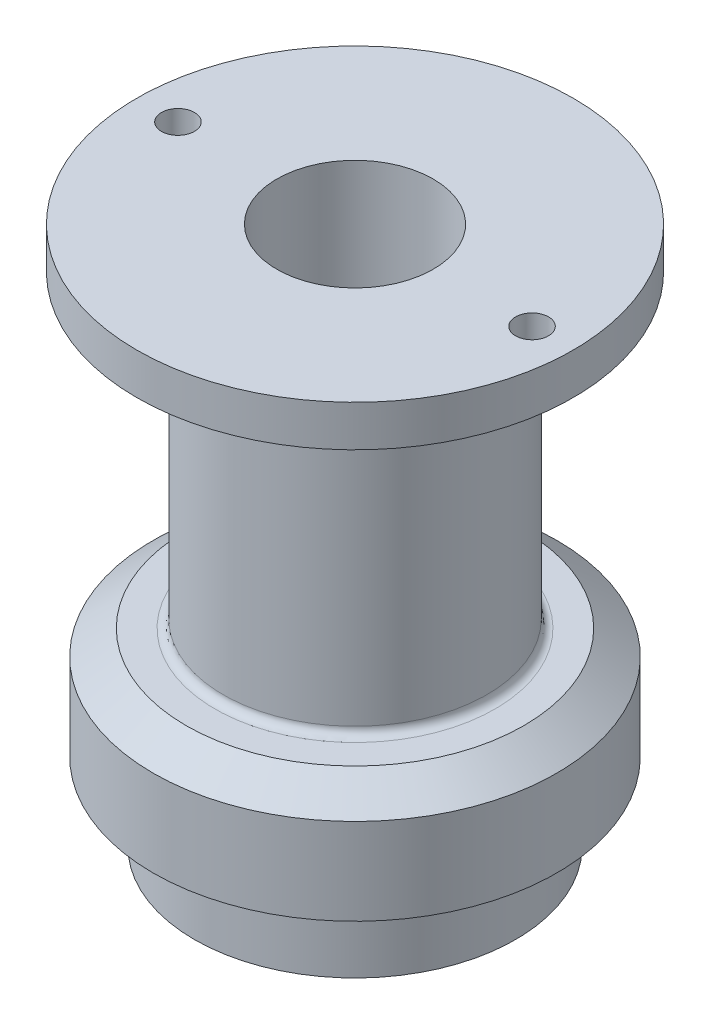
from build123d import *

# Parameters (mm, degrees)
SKETCH2_R          = 2
CUT_EXTRUDE1_DEPTH = 10


with BuildPart() as part:
    # Sketch1 → Revolve1 (revolve)
    with BuildSketch(Plane.XY, mode=Mode.PRIVATE) as revolve1_sk:
        with BuildLine():
            Line((13.5, 0), (19.5, 0))
            Line((19.5, 0), (19.5, 8))
            Line((19.5, 8), (18, 8))
            Line((18, 8), (18, 9.5))
            Line((18, 9.5), (24.5, 9.5))
            Line((24.5, 9.5), (24.5, 20))
            Line((24.5, 20), (20.5, 23))
            Line((20.5, 23), (17, 23))
            ThreePointArc((17, 23), (16.292893219, 23.292893219), (16, 24))
            Line((16, 24), (16, 59.5))
            ThreePointArc((16, 59.5), (16.292893219, 60.207106781), (17, 60.5))
            Line((17, 60.5), (26.5, 60.5))
            Line((26.5, 60.5), (26.5, 65.5))
            Line((26.5, 65.5), (9.5, 65.5))
            Line((9.5, 65.5), (9.5, 48))
            Line((9.5, 48), (6.5, 44.5))
            Line((6.5, 44.5), (6.5, 37.5))
            Line((6.5, 37.5), (7, 37))
            Line((7, 37), (7, 17))
            Line((7, 17), (6.5, 16.5))
            Line((6.5, 16.5), (6.5, 8))
            Line((6.5, 8), (13.5, 8))
            Line((13.5, 8), (13.5, 0))
        make_face()
    revolve(revolve1_sk.sketch.rotate(Axis((0, 0, 0), (0, 1, 0)), 90), axis=Axis((0, 0, 0), (0, 1, 0)))

    # Sketch2 → Cut-Extrude1 (cut)
    with BuildSketch(Plane(origin=(0, 65.5, 0), x_dir=(1, 0, 0), z_dir=(0, 1, 0))):
        with Locations(Location((21.5, 0, 0), (0, 0, 270))):
            Circle(SKETCH2_R)
        with Locations(Location((-21.5, 0, 0), (0, 0, 270))):
            Circle(SKETCH2_R)
    extrude(amount=-CUT_EXTRUDE1_DEPTH, mode=Mode.SUBTRACT)


solid = part.part
